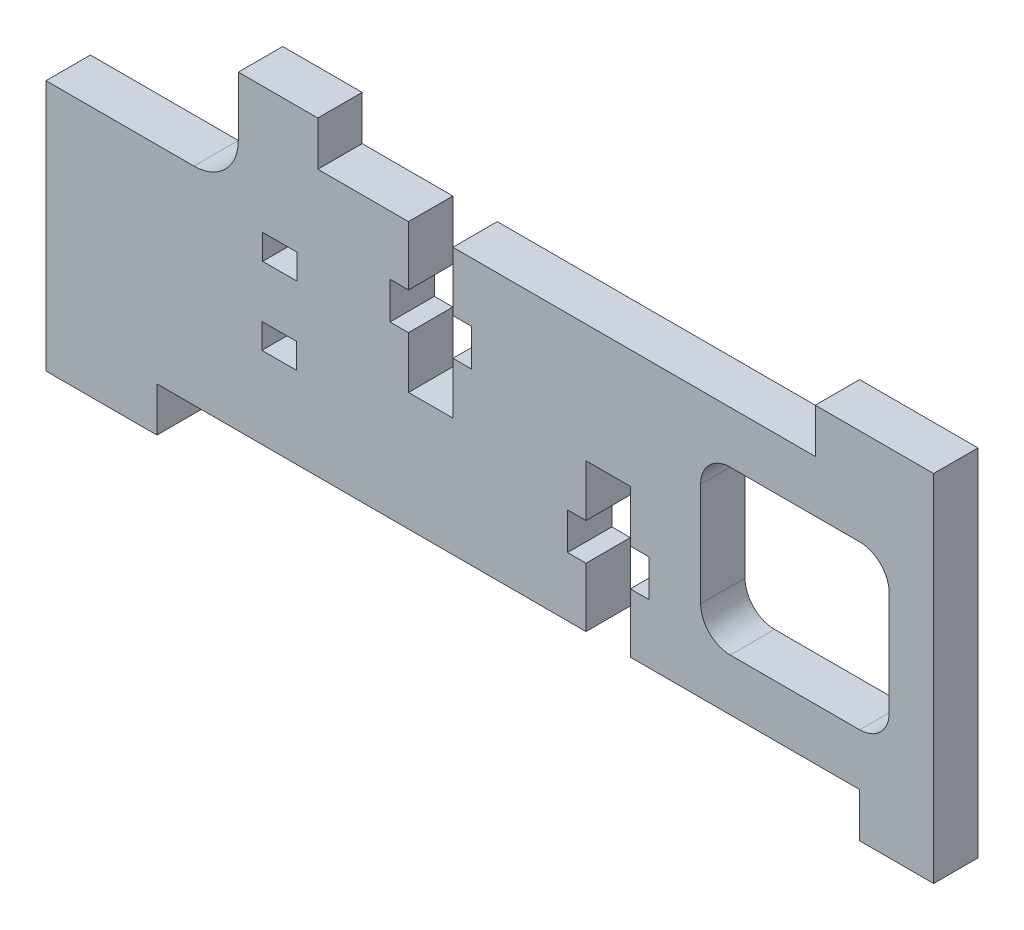
from build123d import *

# Parameters (mm, degrees)
SKETCH_1_W      = 2.3276
SKETCH_1_H      = 1.694
EXTRUDE_1_DEPTH = 3


with BuildPart() as part:
    # 草图1 → 凸台-拉伸1 (new body)
    with BuildSketch(Plane.XY.offset(3)):
        with BuildLine():
            Line((23.2531, 5.583631793), (24.503, 5.583631793))
            Line((24.503, 5.583631793), (24.503, 9.583631793))
            Line((24.503, 9.583631793), (18.3721, 9.583631793))
            Line((18.3721, 9.583631793), (18.3721, 12.583631793))
            Line((18.3721, 12.583631793), (12.9991, 12.583631793))
            Line((12.9991, 12.583631793), (12.9991, 8.582631793))
            ThreePointArc((12.9991, 8.582631793), (12.120420344, 6.461311449), (9.9991, 5.582631793))
            Line((9.9991, 5.582631793), (0, 5.582631793))
            Line((0, 5.582631793), (0, -11.416368207))
            Line((0, -11.416368207), (7.4994, -11.416368207))
            Line((7.4994, -11.416368207), (7.4994, -8.416368207))
            Line((7.4994, -8.416368207), (36.5002, -8.416368207))
            Line((36.5002, -8.416368207), (36.5002, -4.416368207))
            Line((36.5002, -4.416368207), (35.2489, -4.416368207))
            Line((35.2489, -4.416368207), (35.2489, -1.916368207))
            Line((35.2489, -1.916368207), (36.5002, -1.916368207))
            Line((36.5002, -1.916368207), (36.5002, 1.583631793))
            Line((36.5002, 1.583631793), (39.5003, 1.583631793))
            Line((39.5003, 1.583631793), (39.5003, -1.916368207))
            Line((39.5003, -1.916368207), (40.7501, -1.916368207))
            Line((40.7501, -1.916368207), (40.7501, -4.416368207))
            Line((40.7501, -4.416368207), (39.5003, -4.416368207))
            Line((39.5003, -4.416368207), (39.5003, -8.416368207))
            Line((39.5003, -8.416368207), (54.9988, -8.416368207))
            Line((54.9988, -8.416368207), (54.9988, -11.416368207))
            Line((54.9988, -11.416368207), (59.9998, -11.416368207))
            Line((59.9998, -11.416368207), (59.9998, 12.583631793))
            Line((59.9998, 12.583631793), (51.9988, 12.583631793))
            Line((51.9988, 12.583631793), (51.9988, 9.583631793))
            Line((51.9988, 9.583631793), (27.5031, 9.583631793))
            Line((27.5031, 9.583631793), (27.5031, 5.583631793))
            Line((27.5031, 5.583631793), (28.7543, 5.583631793))
            Line((28.7543, 5.583631793), (28.7543, 3.083631793))
            Line((28.7543, 3.083631793), (27.5031, 3.083631793))
            Line((27.5031, 3.083631793), (27.5031, -0.416368207))
            Line((27.5031, -0.416368207), (24.503, -0.416368207))
            Line((24.503, -0.416368207), (24.503, 3.083631793))
            Line((24.503, 3.083631793), (23.2531, 3.083631793))
            Line((23.2531, 3.083631793), (23.2531, 5.583631793))
        make_face()
        with BuildLine():
            Line((46.2504, 6.082631793), (54.9998, 6.082631793))
            ThreePointArc((54.9998, 6.082631793), (56.414013562, 5.496845355), (56.9998, 4.082631793))
            Line((56.9998, 4.082631793), (56.9998, -2.916368207))
            ThreePointArc((56.9998, -2.916368207), (56.414013562, -4.330581769), (54.9998, -4.916368207))
            Line((54.9998, -4.916368207), (46.2504, -4.916368207))
            ThreePointArc((46.2504, -4.916368207), (44.836186438, -4.330581769), (44.2504, -2.916368207))
            Line((44.2504, -2.916368207), (44.2504, 4.082631793))
            ThreePointArc((44.2504, 4.082631793), (44.836186438, 5.496845355), (46.2504, 6.082631793))
        make_face(mode=Mode.SUBTRACT)
        with Locations((15.811, 3.177631793)):
            Rectangle(SKETCH_1_W, SKETCH_1_H, mode=Mode.SUBTRACT)
        with Locations((15.7586, -2.060368207)):
            Rectangle(SKETCH_1_W, SKETCH_1_H, mode=Mode.SUBTRACT)
    extrude(amount=-EXTRUDE_1_DEPTH)


solid = part.part
